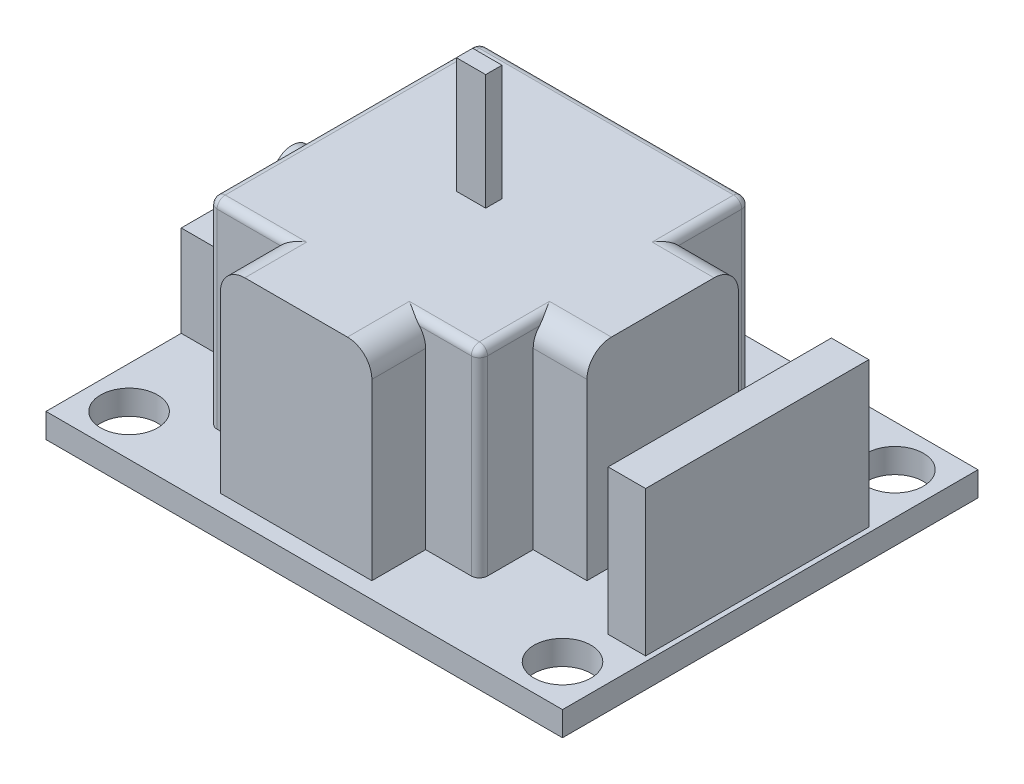
from build123d import *

# Parameters (mm, degrees)
SKETCH1_W                       = 31.7
SKETCH1_H                       = 25.5
BOSS_EXTRUDE1_DEPTH             = 1.5
F_3_0MM_DOWEL_HOLE1_D           = 3.5
F_3_0MM_DOWEL_HOLE1_ON_FACE_2_D = 3.5
BOSS_EXTRUDE2_DEPTH             = 12.2
SKETCH5_W                       = 2.3
SKETCH5_H                       = 13.7
BOSS_EXTRUDE3_DEPTH             = 8.9
SKETCH6_W                       = 5.7
SKETCH6_H                       = 9.3
BOSS_EXTRUDE4_DEPTH             = 5.6
SKETCH7_R                       = 1.2
BOSS_EXTRUDE5_DEPTH             = 3.2
FILLET2_R                       = 1.5
FILLET1_R                       = 0.5
SKETCH8_W                       = 1.8
SKETCH8_H                       = 1
BOSS_EXTRUDE6_DEPTH             = 7.1


with BuildPart() as part:
    # Sketch1 → Boss-Extrude1 (new body)
    with BuildSketch(Plane(origin=(0, 0, 0), x_dir=(1, 0, 0), z_dir=(0, 1, 0))):
        with Locations((15.85, 12.75)):
            Rectangle(SKETCH1_W, SKETCH1_H)
    extrude(amount=BOSS_EXTRUDE1_DEPTH)

    # Ø3.0mm Dowel Hole1 (through all)
    with Locations(Plane(origin=(2.55, 1.5, -22.95), x_dir=(0, 0, 1), z_dir=(0, 1, 0))):
        with Locations((0, 0), (0, 26.6), (20.4, 26.6), (20.4, 0)):
            Hole(F_3_0MM_DOWEL_HOLE1_D / 2)

    # Ø3.0mm Dowel Hole1 on face 2 (through all)
    with Locations(Plane(origin=(39.661564938, 0, -26.520963617), x_dir=(0, 0, 1), z_dir=(0, 1, 0))):
        with Locations((0, 0)):
            Hole(F_3_0MM_DOWEL_HOLE1_ON_FACE_2_D / 2)

    # Sketch4 → Boss-Extrude2 (add)
    with BuildSketch(Plane(origin=(0, 1.5, 0), x_dir=(1, 0, 0), z_dir=(0, 1, 0))):
        Polygon((5.7, 20.9), (22.3, 20.9), (22.3, 16.9), (25.6, 16.9), (25.6, 7.6), (22.3, 7.6), (22.3, 4.3), (19, 4.3), (19, 1), (9.7, 1), (9.7, 4.3), (5.7, 4.3), align=None)
    extrude(amount=BOSS_EXTRUDE2_DEPTH)

    # Sketch5 → Boss-Extrude3 (add)
    with BuildSketch(Plane(origin=(0, 1.5, 0), x_dir=(1, 0, 0), z_dir=(0, 1, 0))):
        with Locations((30.25, 12.25)):
            Rectangle(SKETCH5_W, SKETCH5_H)
    extrude(amount=BOSS_EXTRUDE3_DEPTH)

    # Sketch6 → Boss-Extrude4 (add)
    with BuildSketch(Plane(origin=(0, 1.5, 0), x_dir=(1, 0, 0), z_dir=(0, 1, 0))):
        with Locations((2.85, 12.95)):
            Rectangle(SKETCH6_W, SKETCH6_H)
    extrude(amount=BOSS_EXTRUDE4_DEPTH)

    # Sketch7 → Boss-Extrude5 (add)
    with BuildSketch(Plane.ZY.offset(-5.7)):
        with Locations(Location((-12.6, 9.4, 0), (0, 0, 180))):
            Circle(SKETCH7_R)
    extrude(amount=BOSS_EXTRUDE5_DEPTH)

    # Fillet2
    fillet2_edges = [part.edges().sort_by_distance(p)[0] for p in [
        (9.7, 13.7, -2.65),
        (19, 13.7, -2.65),
        (23.95, 13.7, -7.6),
        (23.95, 13.7, -16.9),
    ]]
    fillet(fillet2_edges, radius=FILLET2_R)

    # Fillet1
    fillet1_edges = [part.edges().sort_by_distance(p)[0] for p in [
        (5.7, 7.6, -20.9),
        (5.7, 7.6, -4.3),
        (22.3, 7.6, -4.3),
        (22.3, 7.6, -20.9),
        (5.7, 13.7, -12.6),
        (8.45, 13.7, -4.3),
        (19.9, 13.7, -4.3),
        (22.3, 13.7, -6.7),
        (22.3, 13.7, -18.15),
        (14, 13.7, -20.9),
    ]]
    fillet(fillet1_edges, radius=FILLET1_R)

    # Sketch8 → Boss-Extrude6 (add)
    with BuildSketch(Plane(origin=(0, 13.7, 0), x_dir=(1, 0, 0), z_dir=(0, 1, 0))):
        with Locations((13.991138348, 12.593671102)):
            Rectangle(SKETCH8_W, SKETCH8_H)
    extrude(amount=BOSS_EXTRUDE6_DEPTH)


solid = part.part
